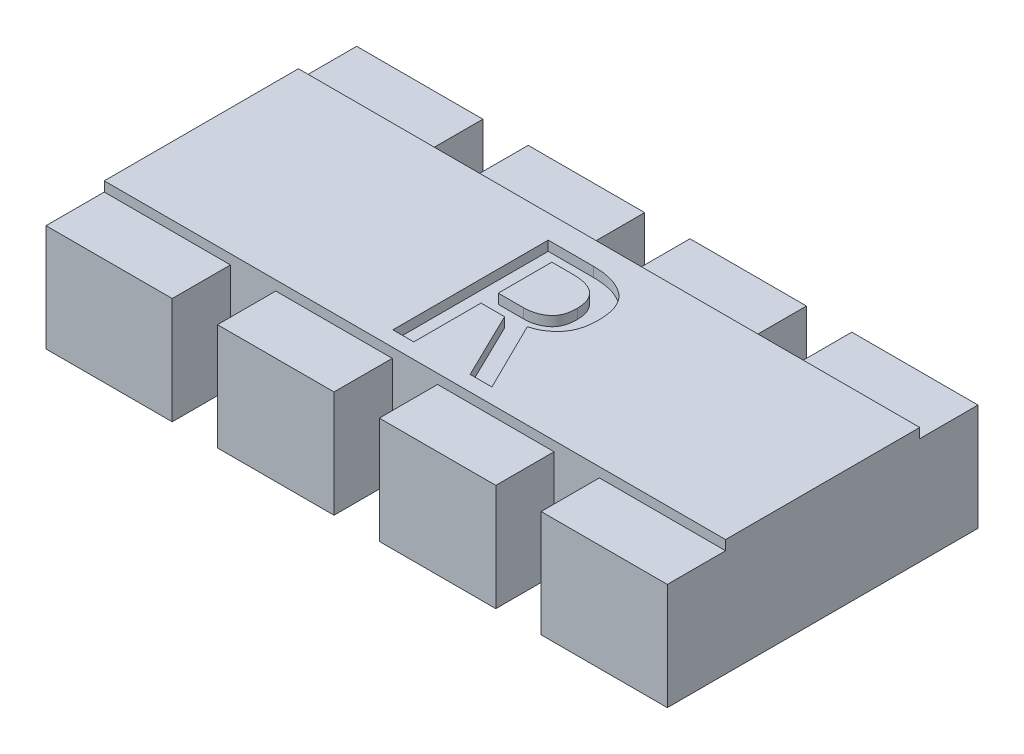
from build123d import *

# Parameters (mm, degrees)
EXTRUDE_1_DEPTH     = 0.55
SKETCH_2_W          = 3.2
SKETCH_2_H          = 1
EXTRUDE_2_DEPTH     = 0.05
CUT_EXTRUDE_1_DEPTH = 0.05


with BuildPart() as part:
    # 草图1 → 凸台-拉伸1 (new body)
    with BuildSketch(Plane(origin=(0, 0, 0), x_dir=(1, 0, 0), z_dir=(0, 1, 0))):
        Polygon((0, 1.6), (0.65, 1.6), (0.65, 1.3), (0.883333333, 1.3), (0.883333333, 1.6), (1.483333333, 1.6), (1.483333333, 1.3), (1.716666667, 1.3), (1.716666667, 1.6), (2.316666667, 1.6), (2.316666667, 1.3), (2.55, 1.3), (2.55, 1.6), (3.2, 1.6), (3.2, 0), (2.55, 0), (2.55, 0.3), (2.316666667, 0.3), (2.316666667, 0), (1.716666667, 0), (1.716666667, 0.3), (1.483333333, 0.3), (1.483333333, 0), (0.883333333, 0), (0.883333333, 0.3), (0.65, 0.3), (0.65, 0), (0, 0), align=None)
    extrude(amount=EXTRUDE_1_DEPTH)

    # 草图2 → 凸台-拉伸2 (add)
    with BuildSketch(Plane(origin=(0, 0.55, 0), x_dir=(1, 0, 0), z_dir=(0, 1, 0))):
        with Locations((1.6, 0.8)):
            Rectangle(SKETCH_2_W, SKETCH_2_H)
    extrude(amount=EXTRUDE_2_DEPTH)

    # 草图3 → 切除-拉伸1 (cut)
    with BuildSketch(Plane(origin=(0, 0.6, 0), x_dir=(1, 0, 0), z_dir=(0, 1, 0))):
        with BuildLine():
            Line((1.917771118, 0.378720107), (1.805490417, 0.378720107))
            Line((1.805490417, 0.378720107), (1.637069364, 0.724918938))
            Line((1.637069364, 0.724918938), (1.515431937, 0.724918938))
            Line((1.515431937, 0.724918938), (1.515431937, 0.378720107))
            Line((1.515431937, 0.378720107), (1.407829598, 0.378720107))
            Line((1.407829598, 0.378720107), (1.407829598, 1.178720107))
            Line((1.407829598, 1.178720107), (1.641747727, 1.178720107))
            add(Edge.make_bspline(
                [(1.641747727, 1.178720107), (1.650877695, 1.178538996), (1.668766176, 1.178184141), (1.694966708, 1.175841662), (1.719794447, 1.171455671), (1.743299904, 1.165540709), (1.765609593, 1.158227469), (1.786446266, 1.148709415), (1.806131061, 1.137846554), (1.824414613, 1.12520671), (1.840963489, 1.110686573), (1.855451783, 1.093952759), (1.867498892, 1.074984486), (1.877520178, 1.053940121), (1.88499041, 1.030775188), (1.890598625, 1.005556873), (1.893854462, 0.978213639), (1.894200851, 0.95925007), (1.894379305, 0.949480341)],
                knots=[0, 0, 0, 0, 1.124851401, 2.203938021, 3.236923468, 4.227547377, 5.188384515, 6.124748074, 7.04535131, 7.955333121, 8.85768773, 9.750678987, 10.67246398, 11.61778816, 12.61462837, 13.664292026, 14.796680505, 16, 16, 16, 16], degree=3))
            add(Edge.make_bspline(
                [(1.894379305, 0.949480341), (1.894269052, 0.941907793), (1.894053913, 0.927131409), (1.891724054, 0.905649007), (1.888142619, 0.885479601), (1.883132103, 0.866607441), (1.876594297, 0.849035527), (1.868343074, 0.83283863), (1.858862404, 0.817841976), (1.844321779, 0.800072595), (1.82423859, 0.780839953), (1.798018465, 0.761803212), (1.769905791, 0.747375988), (1.749929671, 0.741751637), (1.739993341, 0.738954025)],
                knots=[0, 0, 0, 0, 0.960252019, 1.873748618, 2.737466876, 3.556786617, 4.347431233, 5.110891588, 5.858830743, 6.593445102, 8.018399741, 9.372640647, 10.693124067, 12, 12, 12, 12], degree=3))
            Line((1.739993341, 0.738954025), (1.917771118, 0.378720107))
        make_face()
        with BuildLine():
            add(Edge.make_bspline(
                [(1.786776966, 0.949480341), (1.786616632, 0.954797225), (1.786303824, 0.965170359), (1.784660338, 0.980337294), (1.781467707, 0.99458464), (1.777268036, 1.008028632), (1.771328911, 1.02037339), (1.76473626, 1.032129453), (1.756358735, 1.042713613), (1.747065289, 1.052698073), (1.736238719, 1.061559987), (1.723933352, 1.069310308), (1.710025407, 1.075629695), (1.694620701, 1.080805183), (1.677765468, 1.084976529), (1.659330804, 1.087850267), (1.639356253, 1.089600193), (1.625521683, 1.089752388), (1.618355914, 1.089831218)],
                knots=[0, 0, 0, 0, 1.018423225, 1.986923476, 2.915383729, 3.810714658, 4.676600435, 5.533969095, 6.385612358, 7.253966558, 8.141821118, 9.056210967, 10.031005151, 11.059229177, 12.164336364, 13.351610032, 14.628236891, 16, 16, 16, 16], degree=3))
            Line((1.618355914, 1.089831218), (1.515431937, 1.089831218))
            Line((1.515431937, 1.089831218), (1.515431937, 0.813807827))
            Line((1.515431937, 0.813807827), (1.646426089, 0.813807827))
            add(Edge.make_bspline(
                [(1.646426089, 0.813807827), (1.655526373, 0.814152608), (1.673338014, 0.814827436), (1.699062289, 0.820748228), (1.723081192, 0.830209359), (1.741484495, 0.841236085), (1.754801333, 0.852177002), (1.763336542, 0.862083437), (1.770701163, 0.873229329), (1.776545906, 0.885883061), (1.781260065, 0.899810048), (1.784494681, 0.915162638), (1.786369818, 0.931875195), (1.786637933, 0.943468538), (1.786776966, 0.949480341)],
                knots=[0, 0, 0, 0, 1.47184772, 2.880791526, 4.249240139, 5.638178403, 6.335067569, 7.030952029, 7.746845966, 8.491482783, 9.28109559, 10.123026367, 11.02668324, 12, 12, 12, 12], degree=3))
        make_face(mode=Mode.SUBTRACT)
    extrude(amount=-CUT_EXTRUDE_1_DEPTH, mode=Mode.SUBTRACT)


solid = part.part
